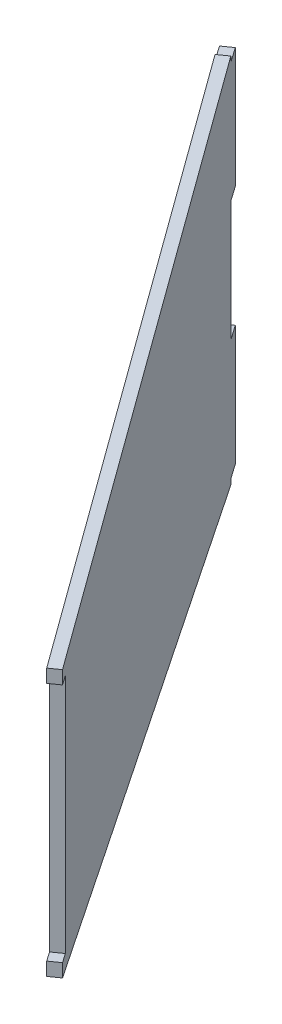
from build123d import *

# Parameters (mm, degrees)
BOSS_EXTRUDE4_DEPTH = 10.6


with BuildPart() as part:
    # Sketch10 → Boss-Extrude4 (new body)
    with BuildSketch(Plane(origin=(5.192841936, 0, -3.641296426), x_dir=(-0.5741295680747442, 0, -0.8187644588416791), z_dir=(0.8187644588416791, 0, -0.5741295680747442))):
        Polygon((-651.749603703, -739.425290644), (-8.651632558, -690.625165342), (-8.651632558, -695.625165342), (8.348367442, -695.625165342), (8.348367442, -808.024914342), (-8.651632558, -808.024914342), (-8.651632558, -920.424663342), (8.348367442, -920.424663342), (8.348367442, -1032.824412342), (-8.651632558, -1032.824412342), (-8.651632558, -1037.824412342), (-651.749603704, -989.024288415), (-651.749603704, -976.624539492), (-641.127651921, -976.624539492), (-641.127651921, -751.825039567), (-651.749603703, -751.825039567), align=None)
    extrude(amount=-BOSS_EXTRUDE4_DEPTH)


solid = part.part
